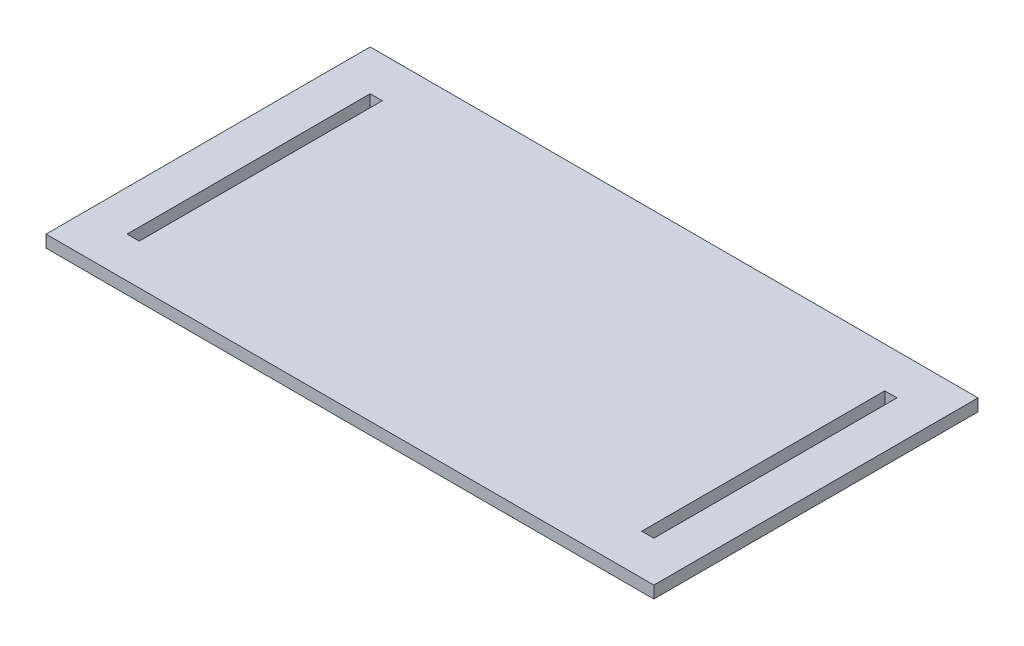
from build123d import *

# Parameters (mm, degrees)
SKETCH1_W           = 150
SKETCH1_H           = 80
BOSS_EXTRUDE1_DEPTH = 3
SKETCH2_W           = 3
SKETCH2_H           = 60
CUT_EXTRUDE1_DEPTH  = 10


with BuildPart() as part:
    # Sketch1 → Boss-Extrude1 (new body)
    with BuildSketch(Plane(origin=(0, 0, 0), x_dir=(1, 0, 0), z_dir=(0, 1, 0))):
        with Locations((75, 40)):
            Rectangle(SKETCH1_W, SKETCH1_H)
    extrude(amount=BOSS_EXTRUDE1_DEPTH)

    # Sketch2 → Cut-Extrude1 (cut)
    with BuildSketch(Plane(origin=(0, 0, 0), x_dir=(1, 0, 0), z_dir=(0, 1, 0))):
        with Locations((11.5, 40)):
            Rectangle(SKETCH2_W, SKETCH2_H)
        with Locations((138.5, 40)):
            Rectangle(SKETCH2_W, SKETCH2_H)
    extrude(amount=CUT_EXTRUDE1_DEPTH, mode=Mode.SUBTRACT)


solid = part.part
